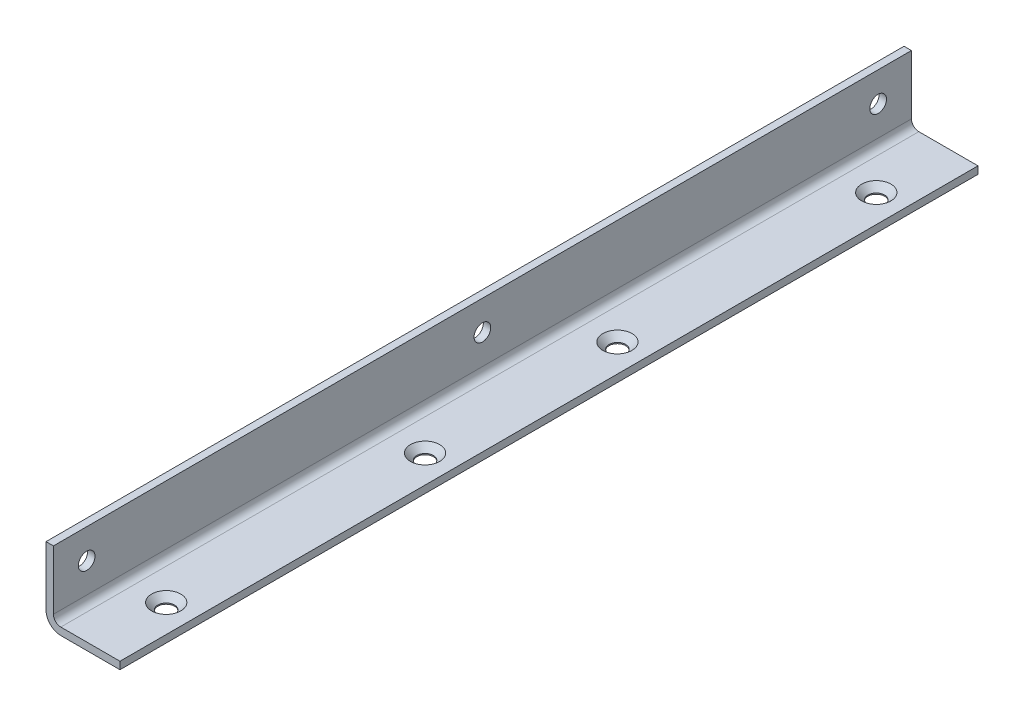
from build123d import *

# Parameters (mm, degrees)
EXTRUDE_1_DEPTH     = 232
SKETCH_2_R          = 2.25
CUT_EXTRUDE_1_DEPTH = 10
SKETCH_3_R          = 2.25
CUT_EXTRUDE_2_DEPTH = 10
CHAMFER_1_SIZE      = 1.7
FILLET_1_R          = 4


with BuildPart() as part:
    # Эскиз1 → Вытянуть1 (new body)
    with BuildSketch(Plane.XY):
        with BuildLine():
            Line((0, 0), (20, 0))
            Line((20, 0), (20, 2))
            Line((20, 2), (4, 2))
            ThreePointArc((4, 2), (2.585786438, 2.585786438), (2, 4))
            Line((2, 4), (2, 20))
            Line((2, 20), (0, 20))
            Line((0, 20), (0, 0))
        make_face()
    extrude(amount=EXTRUDE_1_DEPTH)

    # Эскиз2 → Вырез-Вытянуть1 (cut)
    with BuildSketch(Plane(origin=(2, 0, 0), x_dir=(0, 0, -1), z_dir=(1, 0, 0))):
        with Locations((-223, 12)):
            Circle(SKETCH_2_R)
        with Locations((-9, 12)):
            Circle(SKETCH_2_R)
        with Locations((-116, 12)):
            Circle(SKETCH_2_R)
    extrude(amount=-CUT_EXTRUDE_1_DEPTH, mode=Mode.SUBTRACT)

    # Эскиз3 → Вырез-Вытянуть2 (cut)
    with BuildSketch(Plane(origin=(0, 2, 0), x_dir=(1, 0, 0), z_dir=(0, 1, 0))):
        with Locations(Location((12.5, -212, 0), (0, 0, 270))):
            Circle(SKETCH_3_R)
        with Locations(Location((12.5, -142, 0), (0, 0, 270))):
            Circle(SKETCH_3_R)
        with Locations(Location((12.5, -20, 0), (0, 0, 270))):
            Circle(SKETCH_3_R)
        with Locations(Location((12.5, -90, 0), (0, 0, 270))):
            Circle(SKETCH_3_R)
    extrude(amount=-CUT_EXTRUDE_2_DEPTH, mode=Mode.SUBTRACT)

    # Фаска1
    chamfer_1_edges = [part.edges().sort_by_distance(p)[0] for p in [
        (12.5, 2, 209.75),
        (12.5, 2, 139.75),
        (12.5, 2, 17.75),
        (12.5, 2, 87.75),
    ]]
    chamfer(chamfer_1_edges, length=CHAMFER_1_SIZE)

    # Скругление1
    fillet_1_edges = [part.edges().sort_by_distance(p)[0] for p in [
        (0, 0, 116),
    ]]
    fillet(fillet_1_edges, radius=FILLET_1_R)


solid = part.part
